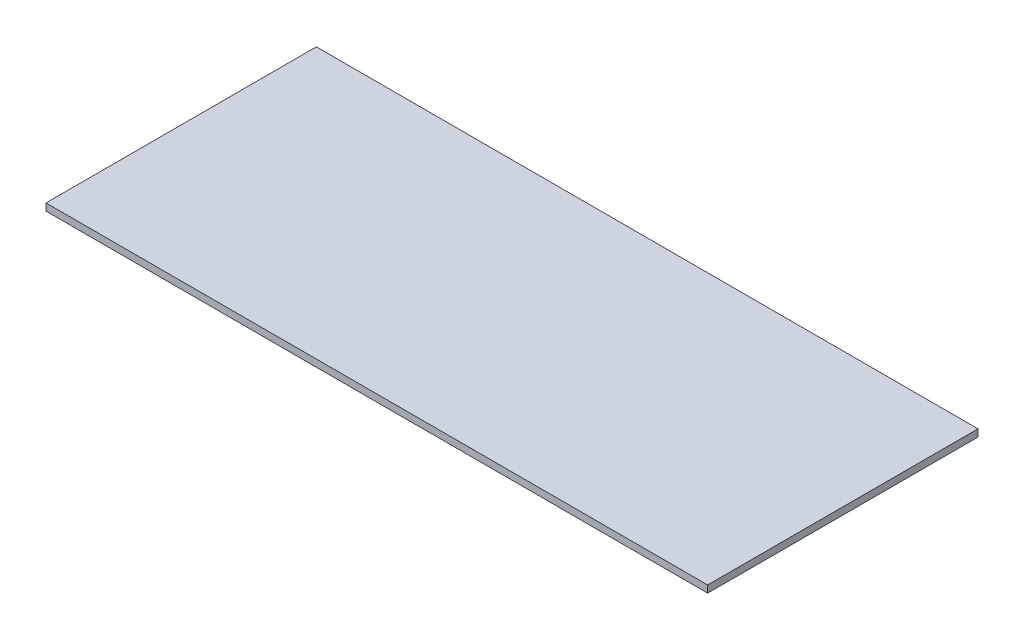
from build123d import *

# Parameters (mm, degrees)
SKETCH1_W           = 118.11
SKETCH1_H           = 48.26
BOSS_EXTRUDE1_DEPTH = 1.27


with BuildPart() as part:
    # Sketch1 → Boss-Extrude1 (new body)
    with BuildSketch(Plane(origin=(0, 0, 0), x_dir=(1, 0, 0), z_dir=(0, 1, 0))):
        with Locations((-16.834321692, -5.899052789)):
            Rectangle(SKETCH1_W, SKETCH1_H)
    extrude(amount=BOSS_EXTRUDE1_DEPTH)


solid = part.part
